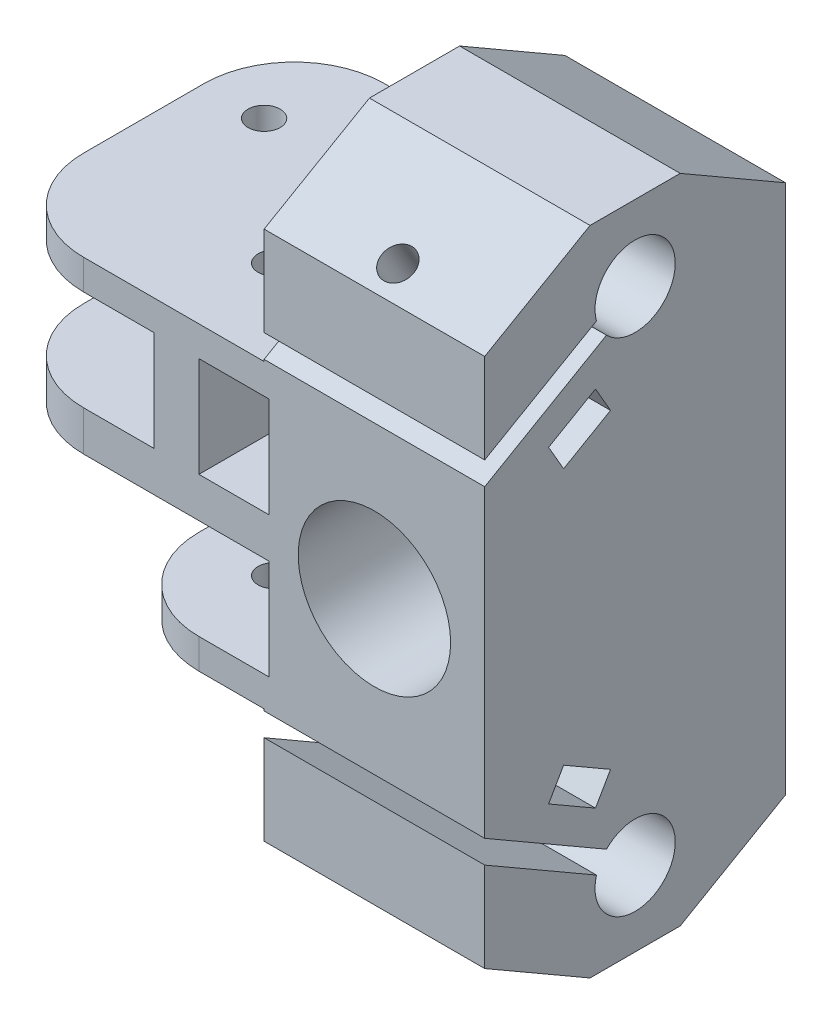
from build123d import *

# Parameters (mm, degrees)
ESBO_O2_R                  = 7.6
ESBO_O2_W                  = 7
ESBO_O2_H                  = 10
RESSALTO_EXTRUS_O1_DEPTH   = 30
CORTE_EXTRUS_O1_DEPTH      = 52.819397912
CORTE_EXTRUS_O2_DEPTH      = 68.825142831
CORTE_EXTRUS_O2_DEPTH_BACK = 68.825142831
ESBO_O4_R                  = 1.6
FILETE2_R                  = 9
CORTE_EXTRUS_O3_DEPTH      = 67.882564304
CORTE_EXTRUS_O3_DEPTH_BACK = 10
ESBO_O7_R                  = 1.6


with BuildPart() as part:
    # Esboço2 → Ressalto-extrusão1 (new body)
    with BuildSketch(Plane.XY):
        Polygon((-11, 15), (-11, 32.5), (11, 32.5), (11, -32.5), (-11, -32.5), (-11, -15), (-26.5, -15), (-26.5, -12), (-10.5, -12), (-10.5, -2), (-26.5, -2), (-38, -2), (-38, 2), (-22, 2), (-22, 12), (-38, 12), (-38, 15), align=None)
        Circle(ESBO_O2_R, mode=Mode.SUBTRACT)
        with Locations((-14, 7)):
            Rectangle(ESBO_O2_W, ESBO_O2_H, mode=Mode.SUBTRACT)
    extrude(amount=RESSALTO_EXTRUS_O1_DEPTH)

    # Esboço3 → Corte-extrusão1 (cut, through all)
    with BuildSketch(Plane.ZY.offset(11)):
        Polygon((30, 26.434795421), (19.494757511, 32.5), (30, 32.5), align=None)
        Polygon((18.952178178, 18.099406712), (23.628715358, 15.399406712), (22.128715358, 12.8013305), (17.452178178, 15.5013305), align=None)
        with BuildLine():
            Line((17.854101966, 22.197482923), (31.133039027, 14.530885036))
            Line((31.133039027, 14.530885036), (32.133039027, 16.262935844))
            Line((32.133039027, 16.262935844), (18.854101966, 23.929533731))
            ThreePointArc((18.854101966, 23.929533731), (11.535898385, 27), (17.854101966, 22.197482923))
        make_face()
        with BuildLine():
            Line((31.133039027, -14.530885036), (32.133039027, -16.262935844))
            Line((32.133039027, -16.262935844), (18.854101966, -23.929533731))
            ThreePointArc((18.854101966, -23.929533731), (11.535898385, -27), (17.854101966, -22.197482923))
            Line((17.854101966, -22.197482923), (31.133039027, -14.530885036))
        make_face()
        Polygon((23.628715358, -15.399406712), (22.128715358, -12.8013305), (17.452178178, -15.5013305), (18.952178178, -18.099406712), align=None)
        Polygon((0, 26.434795421), (10.505242489, 32.5), (0, 32.5), align=None)
        Polygon((30, -32.5), (19.494757511, -32.5), (30, -26.434795421), align=None)
        Polygon((0, -32.5), (10.505242489, -32.5), (0, -26.434795421), align=None)
    extrude(amount=-CORTE_EXTRUS_O1_DEPTH, mode=Mode.SUBTRACT)

    # Esboço4 → Corte-extrusão2 (cut, two sides: drawn at the far end of the back side and taken through both)
    with BuildSketch(Plane(origin=(0, 15, 0), x_dir=(1, 0, 0), z_dir=(0, 1, 0)).offset(-CORTE_EXTRUS_O2_DEPTH_BACK)):
        with Locations(Location((-32, -9, 0), (0, 0, 270))):
            Circle(ESBO_O4_R)
        with Locations(Location((-19, -21, 0), (0, 0, 270))):
            Circle(ESBO_O4_R)
    extrude(amount=CORTE_EXTRUS_O2_DEPTH + CORTE_EXTRUS_O2_DEPTH_BACK, mode=Mode.SUBTRACT)

    # Filete2
    filete2_edges = [part.edges().sort_by_distance(p)[0] for p in [
        (-38, 13.5, 30),
        (-26.5, -13.5, 0),
        (-38, 0, 0),
        (-38, 13.5, 0),
        (-38, 0, 30),
        (-26.5, -13.5, 30),
    ]]
    fillet(filete2_edges, radius=FILETE2_R)

    # Esboço7 → Corte-extrusão3 (cut, two sides: drawn at the far end of the back side and taken through both)
    with BuildSketch(Plane(origin=(0, 19.183012702, 11.075317547), x_dir=(1, 0, 0), z_dir=(0, 0.8660254037844418, 0.4999999999999945)).offset(-CORTE_EXTRUS_O3_DEPTH_BACK)):
        with Locations(Location((0, -10.063364403, 0), (0, 0, 90))):
            Circle(ESBO_O7_R)
    extrude(amount=CORTE_EXTRUS_O3_DEPTH + CORTE_EXTRUS_O3_DEPTH_BACK, mode=Mode.SUBTRACT)


solid = part.part
